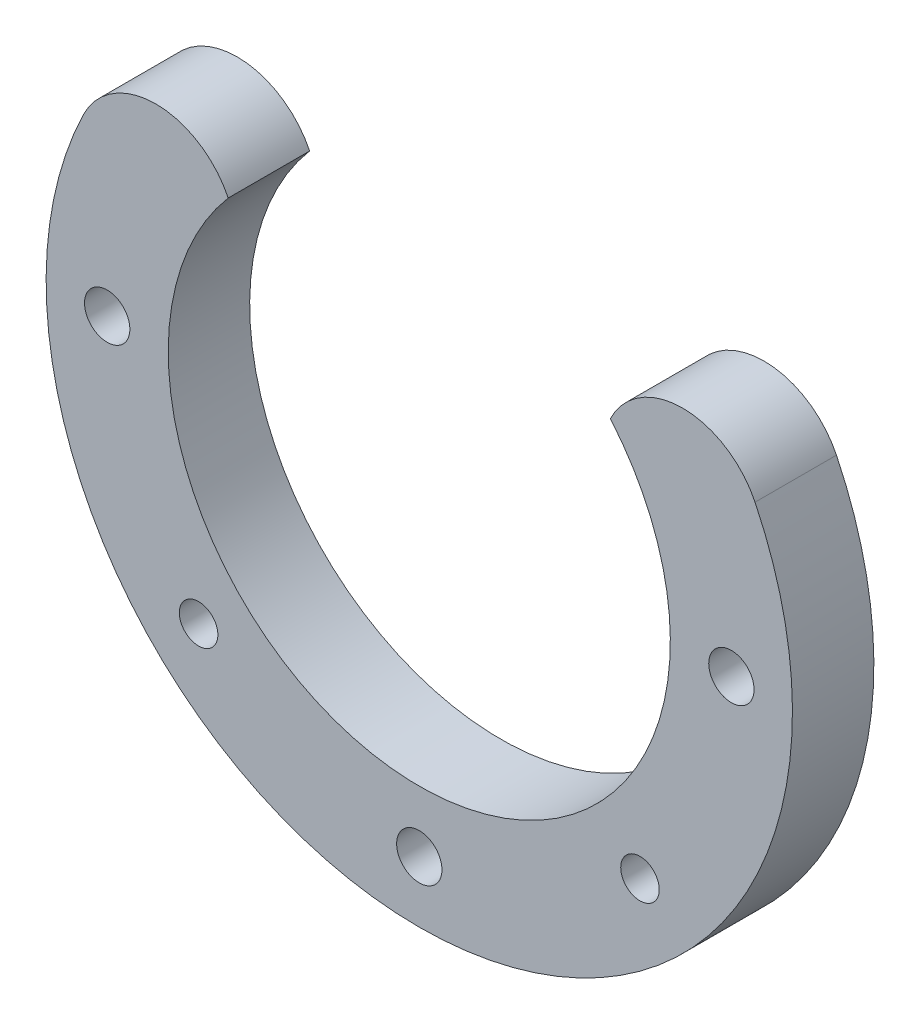
from build123d import *

# Parameters (mm, degrees)
SKETCH1_R           = 1.75
SKETCH1_R_2         = 1.5
BOSS_EXTRUDE1_DEPTH = 6
MOVE_FACE1_BY       = 0.08
MOVE_FACE1_2_BY     = 0.08
MOVE_FACE1_3_BY     = 0.08
MOVE_FACE1_4_BY     = 0.08
MOVE_FACE1_5_BY     = 0.08


with BuildPart() as part:
    # Sketch1 → Boss-Extrude1 (new body)
    with BuildSketch(Plane.XY):
        with BuildLine():
            ThreePointArc((-24.743686063, 12), (0, -27.5), (24.743686063, 12))
            ThreePointArc((24.743686063, 12), (19.411906952, 15.339946038), (14.08012784, 12))
            ThreePointArc((14.08012784, 12), (0, -18.5), (-14.08012784, 12))
            ThreePointArc((-14.08012784, 12), (-19.411906952, 15.339946038), (-24.743686063, 12))
        make_face()
        with Locations((0, -23)):
            Circle(SKETCH1_R, mode=Mode.SUBTRACT)
        with Locations((-16.263455967, -16.263455967)):
            Circle(SKETCH1_R_2, mode=Mode.SUBTRACT)
        with Locations((-23, 0)):
            Circle(SKETCH1_R, mode=Mode.SUBTRACT)
        with Locations((23, 0)):
            Circle(SKETCH1_R, mode=Mode.SUBTRACT)
        with Locations((16.263455967, -16.263455967)):
            Circle(SKETCH1_R_2, mode=Mode.SUBTRACT)
    extrude(amount=BOSS_EXTRUDE1_DEPTH)

    # Move Face1: a curved face moved outward by 0.08
    add(Solid.thicken(part.faces().sort_by_distance((-24.75, 0, 3))[0], MOVE_FACE1_BY))

    # Move Face1 2: a curved face moved outward by 0.08
    add(Solid.thicken(part.faces().sort_by_distance((-1.75, -23, 3))[0], MOVE_FACE1_2_BY))

    # Move Face1 3: a curved face moved outward by 0.08
    add(Solid.thicken(part.faces().sort_by_distance((-17.763455967, -16.263455967, 3))[0], MOVE_FACE1_3_BY))

    # Move Face1 4: a curved face moved outward by 0.08
    add(Solid.thicken(part.faces().sort_by_distance((21.25, 0, 3))[0], MOVE_FACE1_4_BY))

    # Move Face1 5: a curved face moved outward by 0.08
    add(Solid.thicken(part.faces().sort_by_distance((14.763455967, -16.263455967, 3))[0], MOVE_FACE1_5_BY))


solid = part.part
